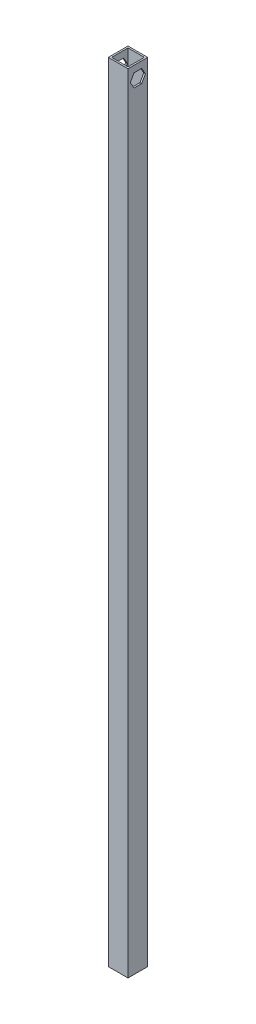
from build123d import *

# Parameters (mm, degrees)
SKETCH1_W           = 38.1
SKETCH1_H           = 38.1
SKETCH1_W_2         = 31.75
SKETCH1_H_2         = 31.75
BOSS_EXTRUDE1_DEPTH = 1524
CUT_EXTRUDE1_DEPTH  = 38.1


with BuildPart() as part:
    # Sketch1 → Boss-Extrude1 (new body)
    with BuildSketch(Plane(origin=(0, 0, 0), x_dir=(1, 0, 0), z_dir=(0, 1, 0))):
        with Locations((19.05, 19.05)):
            Rectangle(SKETCH1_W, SKETCH1_H)
        with Locations((19.05, 19.05)):
            Rectangle(SKETCH1_W_2, SKETCH1_H_2, mode=Mode.SUBTRACT)
    extrude(amount=BOSS_EXTRUDE1_DEPTH)

    # Sketch2 → Cut-Extrude1 (cut)
    with BuildSketch(Plane(origin=(38.1, 0, 0), x_dir=(0, 0, -1), z_dir=(1, 0, 0))):
        Polygon((33.714696837, 1498.6), (26.382348419, 1511.3), (11.717651581, 1511.3), (4.385303163, 1498.6), (11.717651581, 1485.9), (26.382348419, 1485.9), align=None)
    extrude(amount=-CUT_EXTRUDE1_DEPTH, mode=Mode.SUBTRACT)


solid = part.part
